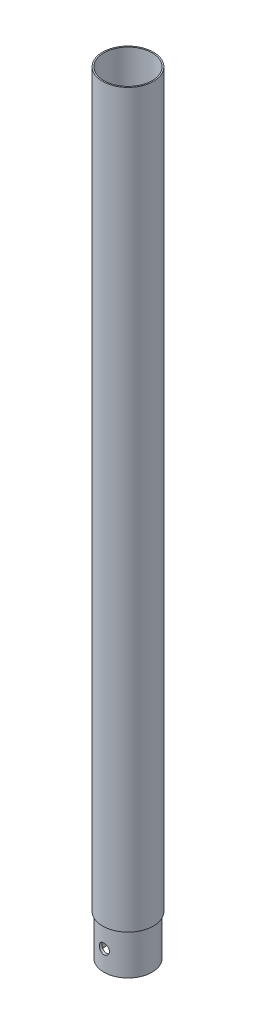
from build123d import *

# Parameters (mm, degrees)
SKETCH1_R                = 31.75
SKETCH1_R_2              = 30.1625
BOSS_EXTRUDE1_DEPTH      = 914.4
BOSS_EXTRUDE2_DEPTH      = 50.8
BOSS_EXTRUDE2_DEPTH_BACK = 25.4
SKETCH3_R                = 30.1625
SKETCH3_R_2              = 26.9875
CUT_EXTRUDE2_DEPTH       = 916.501766792
CUT_EXTRUDE2_DEPTH_BACK  = 916.501766792
SKETCH7_R                = 6.35


with BuildPart() as part:
    # Sketch1 → Boss-Extrude1 (new body)
    with BuildSketch(Plane(origin=(0, 0, 0), x_dir=(1, 0, 0), z_dir=(0, 1, 0))):
        with Locations(Location((0, 0, 0), (0, 0, 270))):
            Circle(SKETCH1_R)
        with Locations(Location((0, 0, 0), (0, 0, 270))):
            Circle(SKETCH1_R_2, mode=Mode.SUBTRACT)
    extrude(amount=BOSS_EXTRUDE1_DEPTH)

    # Sketch3 → Boss-Extrude2 (add, two sides: drawn at the far end of the back side and taken through both)
    with BuildSketch(Plane.XZ.offset(-BOSS_EXTRUDE2_DEPTH_BACK)):
        with Locations(Location((0, 0, 0), (0, 0, 270))):
            Circle(SKETCH3_R)
        with Locations(Location((0, 0, 0), (0, 0, 270))):
            Circle(SKETCH3_R_2, mode=Mode.SUBTRACT)
    extrude(amount=BOSS_EXTRUDE2_DEPTH + BOSS_EXTRUDE2_DEPTH_BACK)

    # Sketch7 → Cut-Extrude2 (cut, two sides: drawn at the far end of the back side and taken through both)
    with BuildSketch(Plane.XY.offset(-CUT_EXTRUDE2_DEPTH_BACK)):
        with Locations((0, -25.4)):
            Circle(SKETCH7_R)
    extrude(amount=CUT_EXTRUDE2_DEPTH + CUT_EXTRUDE2_DEPTH_BACK, mode=Mode.SUBTRACT)


solid = part.part
